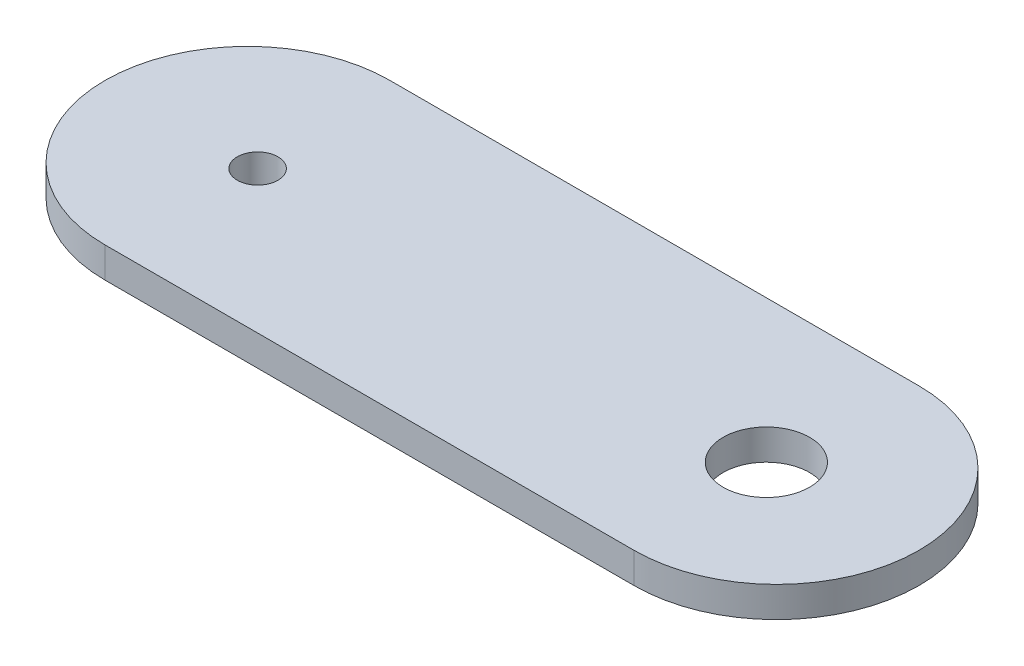
from build123d import *

# Parameters (mm, degrees)
SKETCH_1_W      = 80
SKETCH_1_H      = 28
SKETCH_1_R      = 4.25
SKETCH_1_R_2    = 2
EXTRUDE_1_DEPTH = 3
FILLET_1_RADIUS = 14
FILLET_1_LENGTH = 3
FILLET_2_RADIUS = 14
FILLET_2_LENGTH = 3


with BuildPart() as part:
    # 草图1 → 凸台-拉伸1 (new body)
    with BuildSketch(Plane(origin=(0, 0, 0), x_dir=(1, 0, 0), z_dir=(0, 1, 0))):
        Rectangle(SKETCH_1_W, SKETCH_1_H)
        with Locations(Location((25, 0, 0), (0, 0, 270))):
            Circle(SKETCH_1_R, mode=Mode.SUBTRACT)
        with Locations(Location((-25, 0, 0), (0, 0, 270))):
            Circle(SKETCH_1_R_2, mode=Mode.SUBTRACT)
    extrude(amount=EXTRUDE_1_DEPTH)

    # 圆角1: full round fillet: the end face becomes a half cylinder, R = half its width
    fillet_1_face = Plane((-40, 1.5, 0), x_dir=(0, 1, 0), z_dir=(-1, 0, 0))  # on the end face: x along it, z out of the body
    fillet_1_slab = fillet_1_face.offset(-FILLET_1_RADIUS / 2) * Box(FILLET_1_LENGTH, 2 * FILLET_1_RADIUS, FILLET_1_RADIUS, mode=Mode.PRIVATE)  # the body's end, R deep
    fillet_1_round = Plane((-26, 1.5, 0), x_dir=(-1, 0, 0), z_dir=(0, 1, 0)) * Cylinder(FILLET_1_RADIUS, FILLET_1_LENGTH, mode=Mode.PRIVATE)  # its axis R under the face
    add(fillet_1_slab - fillet_1_round, mode=Mode.SUBTRACT)

    # 圆角2: full round fillet: the end face becomes a half cylinder, R = half its width
    fillet_2_face = Plane((40, 1.5, 0), x_dir=(0, -1, 0), z_dir=(1, 0, 0))  # on the end face: x along it, z out of the body
    fillet_2_slab = fillet_2_face.offset(-FILLET_2_RADIUS / 2) * Box(FILLET_2_LENGTH, 2 * FILLET_2_RADIUS, FILLET_2_RADIUS, mode=Mode.PRIVATE)  # the body's end, R deep
    fillet_2_round = Plane((26, 1.5, 0), x_dir=(1, 0, 0), z_dir=(0, -1, 0)) * Cylinder(FILLET_2_RADIUS, FILLET_2_LENGTH, mode=Mode.PRIVATE)  # its axis R under the face
    add(fillet_2_slab - fillet_2_round, mode=Mode.SUBTRACT)


solid = part.part
